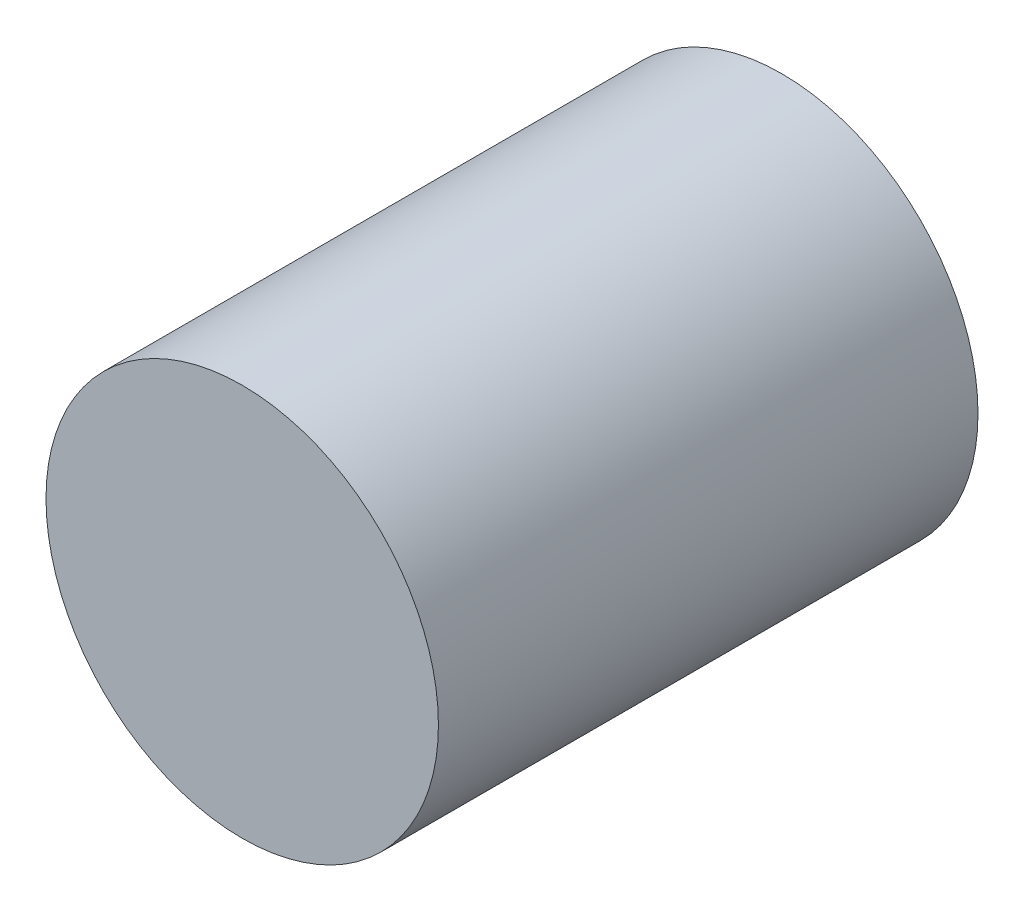
from build123d import *

# Parameters (mm, degrees)
SKETCH1_R           = 20
BOSS_EXTRUDE1_DEPTH = 55


with BuildPart() as part:
    # Sketch1 → Boss-Extrude1 (new body)
    with BuildSketch(Plane(origin=(0, 0, 0), x_dir=(0, 1, 0), z_dir=(0, 0, 1))):
        with Locations(Location((0, 0, 0), (0, 0, 270))):
            Circle(SKETCH1_R)
    extrude(amount=BOSS_EXTRUDE1_DEPTH)


solid = part.part
